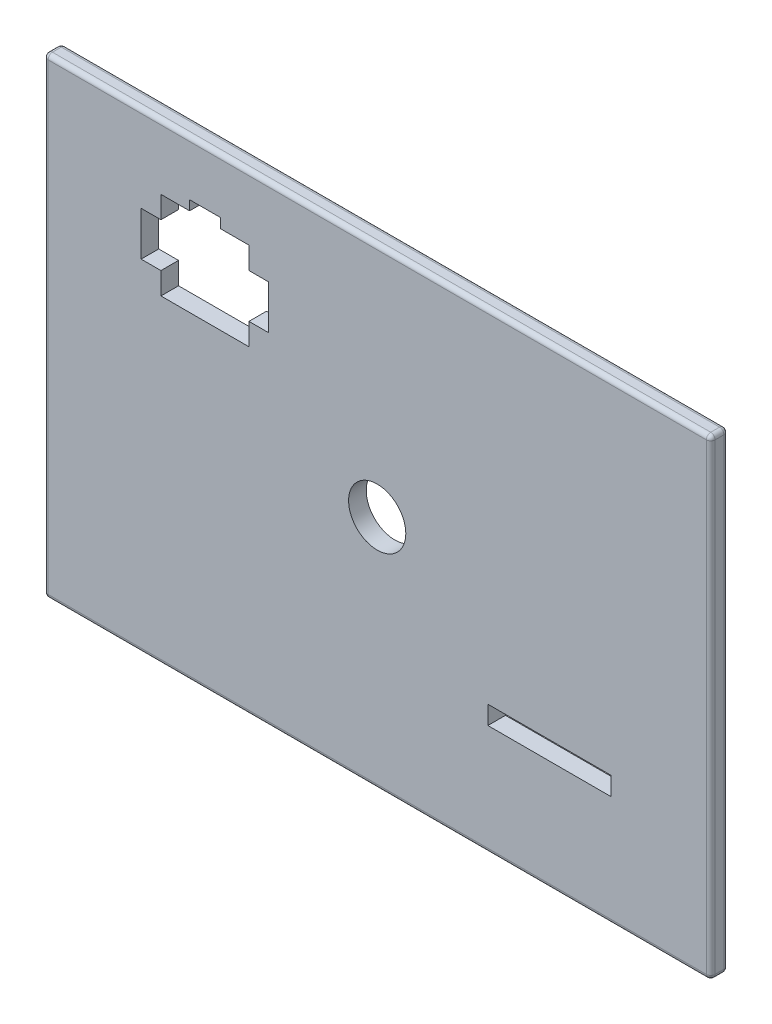
from build123d import *

# Parameters (mm, degrees)
SKETCH1_W           = 75.8
SKETCH1_H           = 53.6
BOSS_EXTRUDE1_DEPTH = 2
SKETCH5_W           = 14
SKETCH5_H           = 2.1
SKETCH5_R           = 3.25
CUT_EXTRUDE1_DEPTH  = 47.461274197
FILLET1_R           = 0.5


with BuildPart() as part:
    # Sketch1 → Boss-Extrude1 (new body)
    with BuildSketch(Plane.XY):
        Rectangle(SKETCH1_W, SKETCH1_H)
    extrude(amount=BOSS_EXTRUDE1_DEPTH)

    # Sketch5 → Cut-Extrude1 (cut, through all)
    with BuildSketch(Plane.XY.offset(2)):
        Polygon((-24.575, 9.475), (-14.575, 9.475), (-14.575, 11.975), (-12.325, 11.975), (-12.325, 16.975), (-14.575, 16.975), (-14.575, 19.475), (-17.825, 19.475), (-17.825, 20.575), (-21.325, 20.575), (-21.325, 19.475), (-24.575, 19.475), (-24.575, 16.975), (-26.825, 16.975), (-26.825, 11.975), (-24.575, 11.975), align=None)
        with Locations((19.575, -13.175)):
            Rectangle(SKETCH5_W, SKETCH5_H)
        Circle(SKETCH5_R)
    extrude(amount=-CUT_EXTRUDE1_DEPTH, mode=Mode.SUBTRACT)

    # Fillet1
    fillet1_edges = [part.edges().sort_by_distance(p)[0] for p in [
        (-37.9, 0, 2),
        (0, -26.8, 2),
        (37.9, 0, 2),
        (0, -26.8, 0),
        (-37.9, 0, 0),
        (0, 26.8, 0),
        (37.9, 0, 0),
        (37.9, -26.8, 1),
        (-37.9, -26.8, 1),
        (-37.9, 26.8, 1),
        (37.9, 26.8, 1),
        (0, 26.8, 2),
    ]]
    fillet(fillet1_edges, radius=FILLET1_R)


solid = part.part
